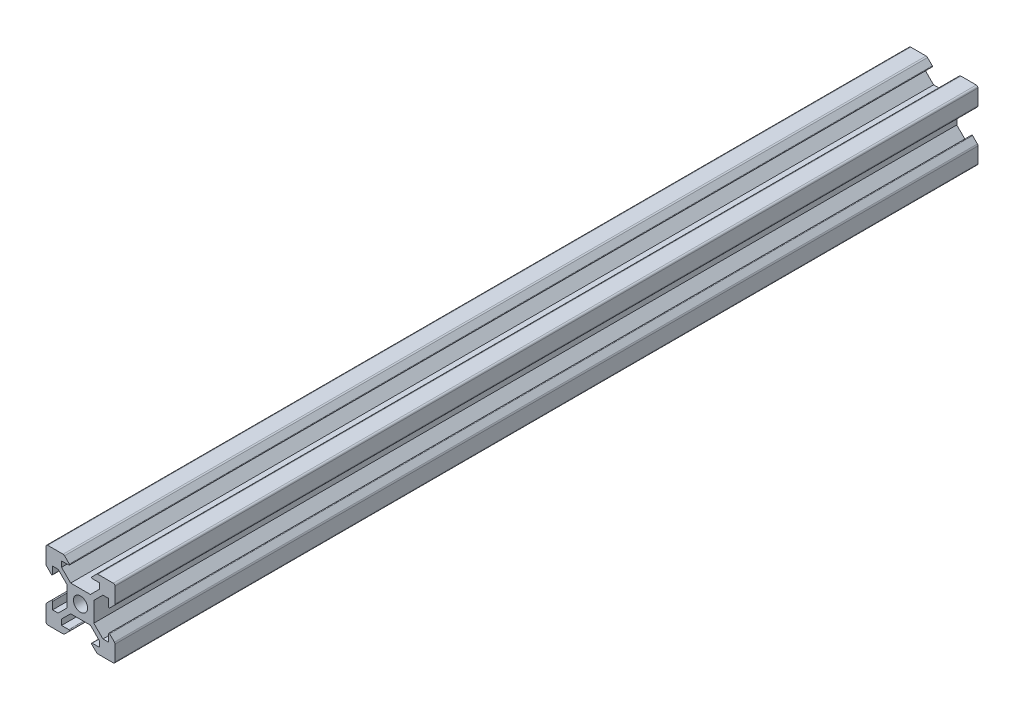
from build123d import *

# Parameters (mm, degrees)
SKETCH1_R           = 2.05
BOSS_EXTRUDE1_DEPTH = 250


with BuildPart() as part:
    # Sketch1 → Boss-Extrude1 (new body)
    with BuildSketch(Plane(origin=(0, 0, 0), x_dir=(0, 1, 0), z_dir=(0, 0, 1))):
        with BuildLine():
            Line((-2.860050506, -3.85), (2.860050506, -3.85))
            Line((2.860050506, -3.85), (5.5, -6.489949494))
            Line((5.5, -6.489949494), (5.5, -8.1))
            Line((5.5, -8.1), (3.382842712, -8.1))
            ThreePointArc((3.382842712, -8.1), (3.198066806, -8.223463314), (3.241421356, -8.441421356))
            Line((3.241421356, -8.441421356), (4.624264069, -9.824264069))
            ThreePointArc((4.624264069, -9.824264069), (4.818918078, -9.95432772), (5.048528137, -10))
            Line((5.048528137, -10), (9.5, -10))
            ThreePointArc((9.5, -10), (9.853553391, -9.853553391), (10, -9.5))
            Line((10, -9.5), (10, -5.048528137))
            ThreePointArc((10, -5.048528137), (9.95432772, -4.818918078), (9.824264069, -4.624264069))
            Line((9.824264069, -4.624264069), (8.441421356, -3.241421356))
            ThreePointArc((8.441421356, -3.241421356), (8.223463314, -3.198066806), (8.1, -3.382842712))
            Line((8.1, -3.382842712), (8.1, -5.5))
            Line((8.1, -5.5), (6.489949494, -5.5))
            Line((6.489949494, -5.5), (3.85, -2.860050506))
            Line((3.85, -2.860050506), (3.85, 2.860050506))
            Line((3.85, 2.860050506), (6.489949494, 5.5))
            Line((6.489949494, 5.5), (8.1, 5.5))
            Line((8.1, 5.5), (8.1, 3.382842712))
            ThreePointArc((8.1, 3.382842712), (8.223463314, 3.198066806), (8.441421356, 3.241421356))
            Line((8.441421356, 3.241421356), (9.824264069, 4.624264069))
            ThreePointArc((9.824264069, 4.624264069), (9.95432772, 4.818918078), (10, 5.048528137))
            Line((10, 5.048528137), (10, 9.5))
            ThreePointArc((10, 9.5), (9.853553391, 9.853553391), (9.5, 10))
            Line((9.5, 10), (5.048528137, 10))
            ThreePointArc((5.048528137, 10), (4.818918078, 9.95432772), (4.624264069, 9.824264069))
            Line((4.624264069, 9.824264069), (3.241421356, 8.441421356))
            ThreePointArc((3.241421356, 8.441421356), (3.198066806, 8.223463314), (3.382842712, 8.1))
            Line((3.382842712, 8.1), (5.5, 8.1))
            Line((5.5, 8.1), (5.5, 6.489949494))
            Line((5.5, 6.489949494), (2.860050506, 3.85))
            Line((2.860050506, 3.85), (-2.860050506, 3.85))
            Line((-2.860050506, 3.85), (-5.5, 6.489949494))
            Line((-5.5, 6.489949494), (-5.5, 8.1))
            Line((-5.5, 8.1), (-3.382842712, 8.1))
            ThreePointArc((-3.382842712, 8.1), (-3.198066806, 8.223463314), (-3.241421356, 8.441421356))
            Line((-3.241421356, 8.441421356), (-4.624264069, 9.824264069))
            ThreePointArc((-4.624264069, 9.824264069), (-4.818918078, 9.95432772), (-5.048528137, 10))
            Line((-5.048528137, 10), (-9.5, 10))
            ThreePointArc((-9.5, 10), (-9.853553391, 9.853553391), (-10, 9.5))
            Line((-10, 9.5), (-10, 5.048528137))
            ThreePointArc((-10, 5.048528137), (-9.95432772, 4.818918078), (-9.824264069, 4.624264069))
            Line((-9.824264069, 4.624264069), (-8.441421356, 3.241421356))
            ThreePointArc((-8.441421356, 3.241421356), (-8.223463314, 3.198066806), (-8.1, 3.382842712))
            Line((-8.1, 3.382842712), (-8.1, 5.5))
            Line((-8.1, 5.5), (-6.489949494, 5.5))
            Line((-6.489949494, 5.5), (-3.85, 2.860050506))
            Line((-3.85, 2.860050506), (-3.85, -2.860050506))
            Line((-3.85, -2.860050506), (-6.489949494, -5.5))
            Line((-6.489949494, -5.5), (-8.1, -5.5))
            Line((-8.1, -5.5), (-8.1, -3.382842712))
            ThreePointArc((-8.1, -3.382842712), (-8.223463314, -3.198066806), (-8.441421356, -3.241421356))
            Line((-8.441421356, -3.241421356), (-9.824264069, -4.624264069))
            ThreePointArc((-9.824264069, -4.624264069), (-9.95432772, -4.818918078), (-10, -5.048528137))
            Line((-10, -5.048528137), (-10, -9.5))
            ThreePointArc((-10, -9.5), (-9.853553391, -9.853553391), (-9.5, -10))
            Line((-9.5, -10), (-5.048528137, -10))
            ThreePointArc((-5.048528137, -10), (-4.818918078, -9.95432772), (-4.624264069, -9.824264069))
            Line((-4.624264069, -9.824264069), (-3.241421356, -8.441421356))
            ThreePointArc((-3.241421356, -8.441421356), (-3.198066806, -8.223463314), (-3.382842712, -8.1))
            Line((-3.382842712, -8.1), (-5.5, -8.1))
            Line((-5.5, -8.1), (-5.5, -6.489949494))
            Line((-5.5, -6.489949494), (-2.860050506, -3.85))
        make_face()
        with Locations(Location((0, 0, 0), (0, 0, 270))):
            Circle(SKETCH1_R, mode=Mode.SUBTRACT)
    extrude(amount=BOSS_EXTRUDE1_DEPTH)


solid = part.part
